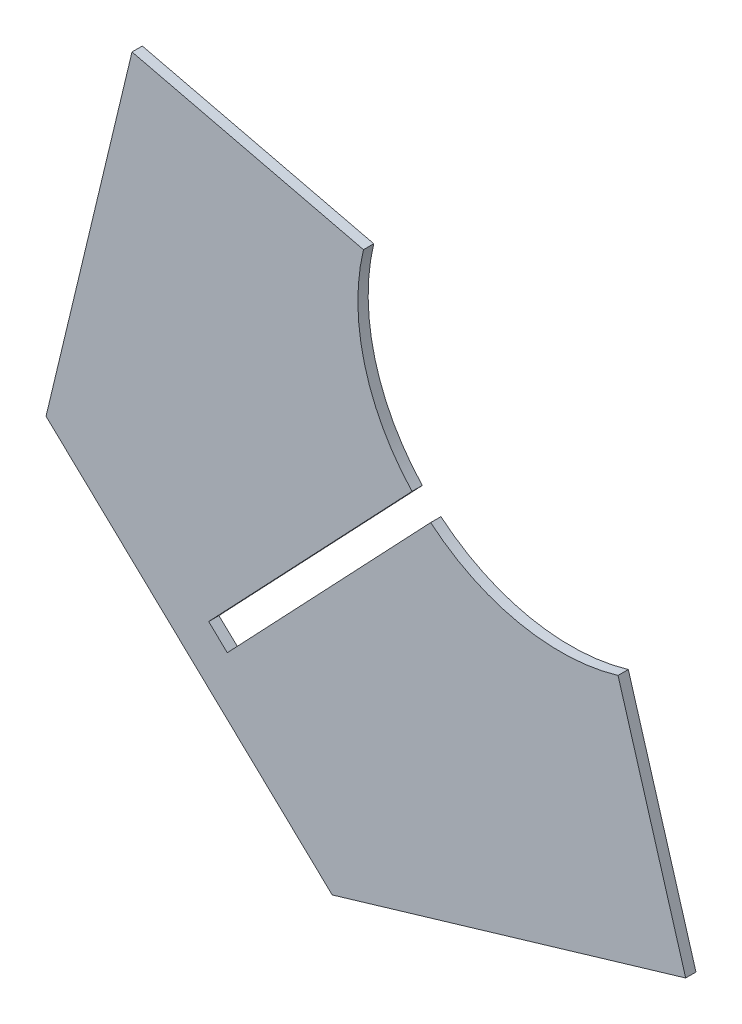
from build123d import *

# Parameters (mm, degrees)
BOSS_EXTRU_1_DEPTH      = 4
ENL_V_MAT_EXTRU_2_DEPTH = 10


with BuildPart() as part:
    # Esquisse1 → Boss.-Extru.1 (new body)
    with BuildSketch(Plane.XY):
        with BuildLine():
            Line((-252.479191453, -50.401668407), (-36.99219102, -254.789419126))
            Line((-36.99219102, -254.789419126), (48.52273895, -164.630612218))
            Line((48.52273895, -164.630612218), (22.191553545, -75.81909358))
            ThreePointArc((22.191553545, -75.81909358), (-16.163403148, -77.442245684), (-50.738038063, -60.758962249))
            Line((-50.738038063, -60.758962249), (-129.87807622, -144.196689689))
            Line((-129.87807622, -144.196689689), (-137.13353078, -137.314947241))
            Line((-137.13353078, -137.314947241), (-57.993492623, -53.8772198))
            ThreePointArc((-57.993492623, -53.8772198), (-76.480137606, -20.232290272), (-76.885637492, 18.154854653))
            Line((-76.885637492, 18.154854653), (-166.964261484, 39.757138501))
            Line((-166.964261484, 39.757138501), (-252.479191453, -50.401668407))
        make_face()
    extrude(amount=-BOSS_EXTRU_1_DEPTH)

    # Esquisse3 → Enlèv. mat.-Extru.2 (cut)
    with BuildSketch(Plane.XY):
        Polygon((-166.964261484, 39.757138501), (-200.425980015, -99.773736244), (-252.479191453, -50.401668407), align=None)
        Polygon((-36.99219102, -254.789419126), (48.52273895, -164.630612218), (-89.045402457, -205.417351289), align=None)
    extrude(amount=-ENL_V_MAT_EXTRU_2_DEPTH, mode=Mode.SUBTRACT)


solid = part.part
